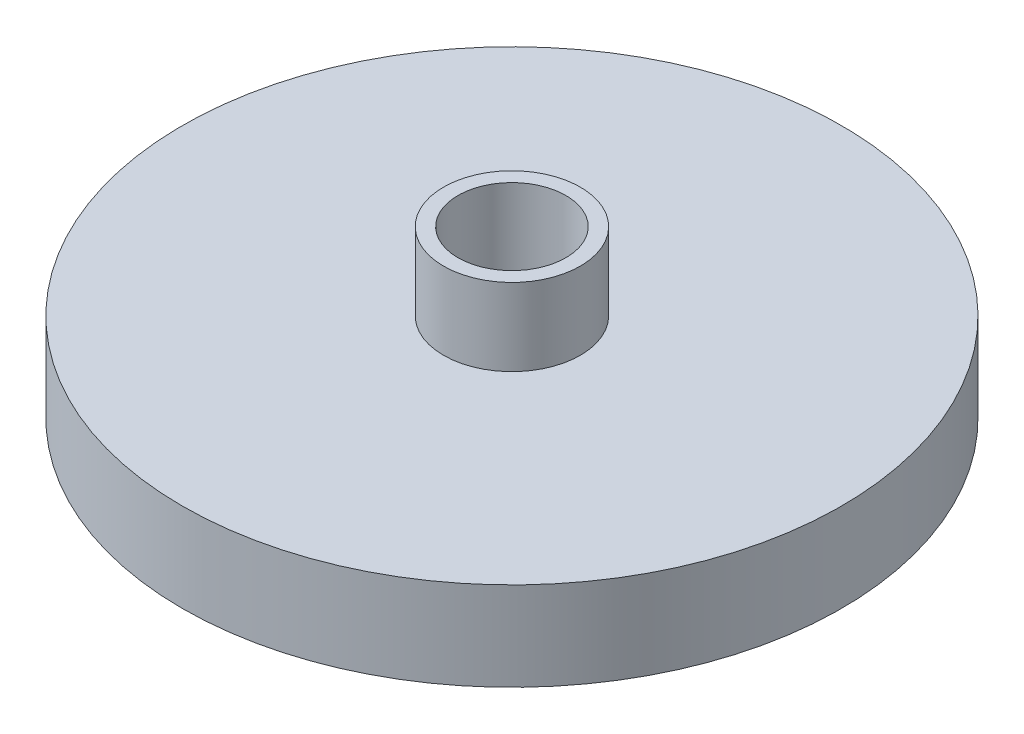
from build123d import *

# Parameters (mm, degrees)
SKETCH1_R           = 19.3929
BOSS_EXTRUDE1_DEPTH = 5.22
SKETCH2_R           = 3.175
CUT_EXTRUDE1_DEPTH  = 28.918050448
BOSS_EXTRUDE2_START = 4.5466
SKETCH3_R           = 4.0259
SKETCH3_R_2         = 3.175
BOSS_EXTRUDE2_DEPTH = 4.5466


with BuildPart() as part:
    # Sketch1 → Boss-Extrude1 (new body)
    with BuildSketch(Plane(origin=(0, 0, 0), x_dir=(1, 0, 0), z_dir=(0, 1, 0))):
        with Locations(Location((0, 0, 0), (0, 0, 270))):
            Circle(SKETCH1_R)
    extrude(amount=BOSS_EXTRUDE1_DEPTH)

    # Sketch2 → Cut-Extrude1 (cut, through all)
    with BuildSketch(Plane(origin=(0, 5.22, 0), x_dir=(1, 0, 0), z_dir=(0, 1, 0))):
        with Locations(Location((0, 0, 0), (0, 0, 270))):
            Circle(SKETCH2_R)
    extrude(amount=-CUT_EXTRUDE1_DEPTH, mode=Mode.SUBTRACT)

    # Sketch3 → Boss-Extrude2 (add)
    with BuildSketch(Plane(origin=(0, 5.22, 0), x_dir=(1, 0, 0), z_dir=(0, 1, 0)).offset(BOSS_EXTRUDE2_START)):
        with Locations(Location((0, 0, 0), (0, 0, 270))):
            Circle(SKETCH3_R)
        with Locations(Location((0, 0, 0), (0, 0, 270))):
            Circle(SKETCH3_R_2, mode=Mode.SUBTRACT)
    extrude(amount=-BOSS_EXTRUDE2_DEPTH)


solid = part.part
